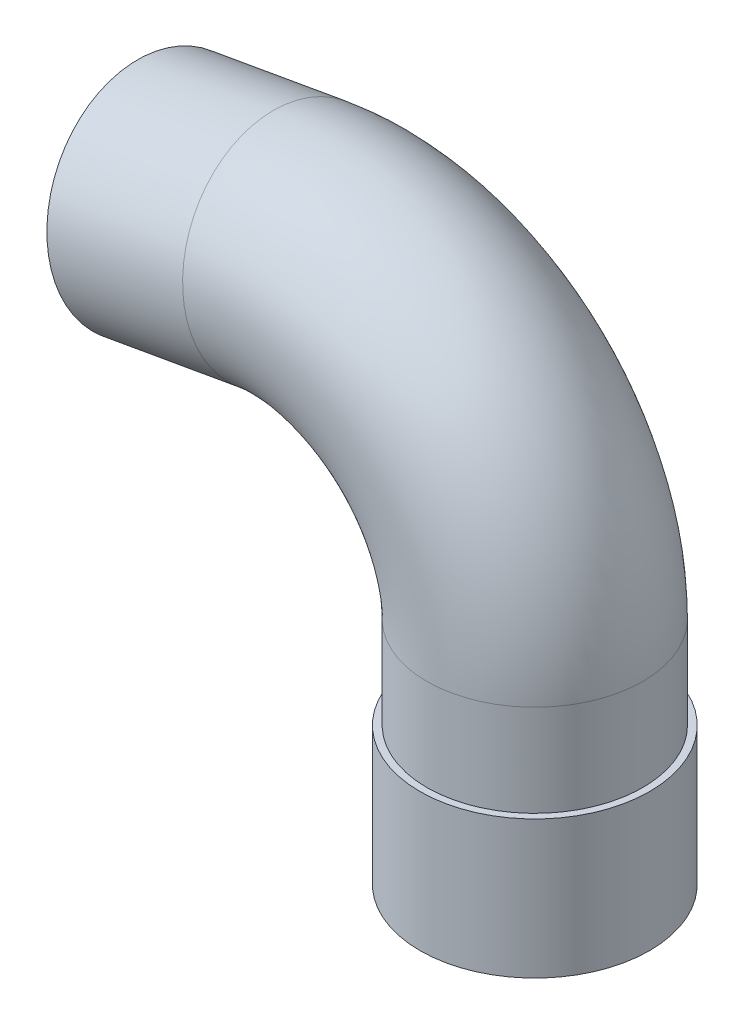
from build123d import *

# Parameters (mm, degrees)
SKETCH_1_R           = 23.5
SKETCH_1_R_2         = 22
EXTRUDE_1_DEPTH      = 20
EXTRUDE_1_DEPTH_BACK = 10
SKETCH_3_R           = 25
SKETCH_3_R_2         = 23


with BuildPart() as part:
    # 扫描1: sweep along a path in 草图2
    with BuildLine(Plane.XY) as sweep_1_path:
        Line((0, 0), (0, 30))
        ThreePointArc((0, 30), (-16.074557564, 64.47199994), (-52.814167995, 74.316348886))
        Line((-52.814167995, 74.316348886), (-82.358400585, 69.106903556))
    # 草图1 → 扫描1 (sweep)
    with BuildSketch(Plane(origin=(0, 0, 0), x_dir=(1, 0, 0), z_dir=(0, 1, 0))):
        Circle(SKETCH_1_R)
        Circle(SKETCH_1_R_2, mode=Mode.SUBTRACT)
    sweep(path=sweep_1_path.line)


with BuildPart() as body_2:
    # 草图3 → 凸台-拉伸1 (new, two sides: drawn at the far end of the back side and taken through both)
    with BuildSketch(Plane(origin=(0, 0, 58.765701135), x_dir=(1, 0, 0), z_dir=(0, -1, 0)).offset(-EXTRUDE_1_DEPTH_BACK)):
        with Locations(Location((0, -58.765701135, 0), (0, 0, 270))):
            Circle(SKETCH_3_R)
        with Locations(Location((0, -58.765701135, 0), (0, 0, 270))):
            Circle(SKETCH_3_R_2, mode=Mode.SUBTRACT)
    extrude(amount=EXTRUDE_1_DEPTH + EXTRUDE_1_DEPTH_BACK)


solid = Compound([part.part, body_2.part])
